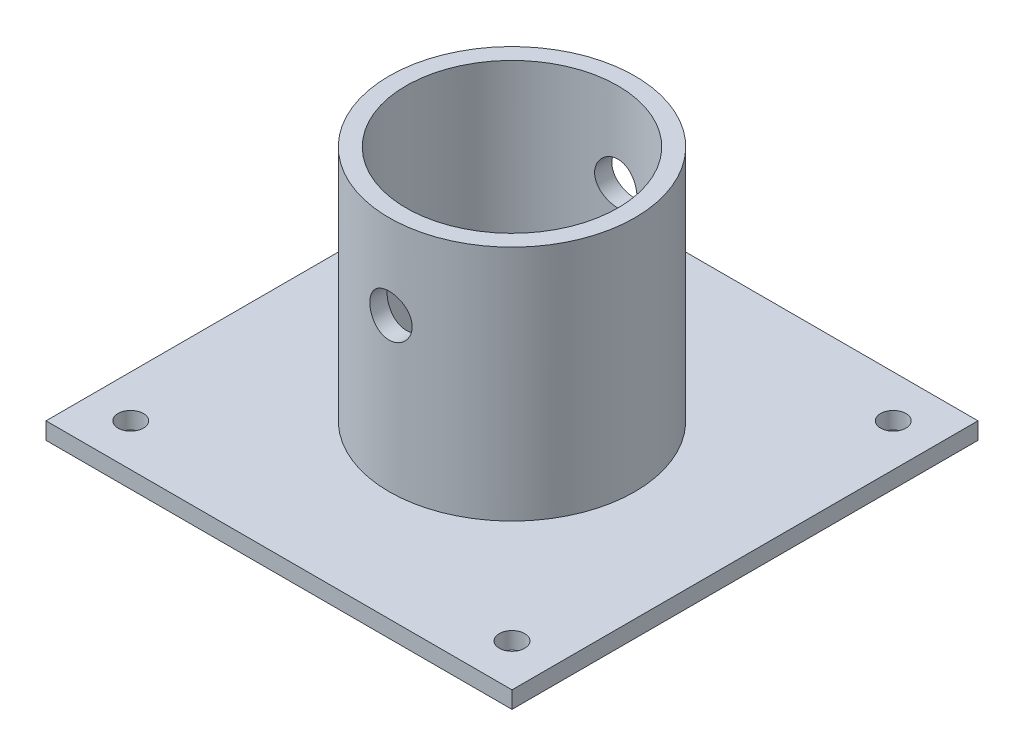
from build123d import *

# Parameters (mm, degrees)
SKETCH_1_W               = 55
SKETCH_1_H               = 55
SKETCH_1_R               = 12.5
EXTRUDE_1_DEPTH          = 2
SKETCH_2_R               = 14.5
SKETCH_2_R_2             = 12.5
EXTRUDE_1_2_DEPTH        = 30
CUT_EXTRUDE_1_DEPTH      = 50.117206761
CUT_EXTRUDE_1_DEPTH_BACK = 50.117206761
SKETCH_3_R               = 2.5
CUT_EXTRUDE_7_DEPTH      = 50.117206822
CUT_EXTRUDE_7_DEPTH_BACK = 50.117206822
SKETCH_4_R               = 1.5


with BuildPart() as part:
    # Эскиз1 → Extrude 1 (new body)
    with BuildSketch(Plane(origin=(0, 0, 0), x_dir=(1, 0, 0), z_dir=(0, 1, 0))):
        Rectangle(SKETCH_1_W, SKETCH_1_H)
        with Locations(Location((0, 0, 0), (0, 0, 270))):
            Circle(SKETCH_1_R, mode=Mode.SUBTRACT)
    extrude(amount=EXTRUDE_1_DEPTH)

    # Эскиз2 → Extrude 1 2 (add)
    with BuildSketch(Plane.XZ):
        Circle(SKETCH_2_R)
        Circle(SKETCH_2_R_2, mode=Mode.SUBTRACT)
    extrude(amount=-EXTRUDE_1_2_DEPTH)

    # Эскиз3 → Вырез-Вытянуть1 (cut, two sides: drawn at the far end of the back side and taken through both)
    with BuildSketch(Plane.XY.offset(-CUT_EXTRUDE_1_DEPTH_BACK)):
        with Locations((0, 20)):
            Circle(SKETCH_3_R)
    extrude(amount=CUT_EXTRUDE_1_DEPTH + CUT_EXTRUDE_1_DEPTH_BACK, mode=Mode.SUBTRACT)

    # Эскиз4 → Вырез-Вытянуть7 (cut, two sides: drawn at the far end of the back side and taken through both)
    with BuildSketch(Plane(origin=(0, 0, 0), x_dir=(1, 0, 0), z_dir=(0, 1, 0)).offset(-CUT_EXTRUDE_7_DEPTH_BACK)):
        with Locations(Location((-22.5, 22.5, 0), (0, 0, 270))):
            Circle(SKETCH_4_R)
        with Locations(Location((22.5, 22.5, 0), (0, 0, 270))):
            Circle(SKETCH_4_R)
        with Locations(Location((22.5, -22.5, 0), (0, 0, 270))):
            Circle(SKETCH_4_R)
        with Locations(Location((-22.5, -22.5, 0), (0, 0, 270))):
            Circle(SKETCH_4_R)
    extrude(amount=CUT_EXTRUDE_7_DEPTH + CUT_EXTRUDE_7_DEPTH_BACK, mode=Mode.SUBTRACT)


solid = part.part
